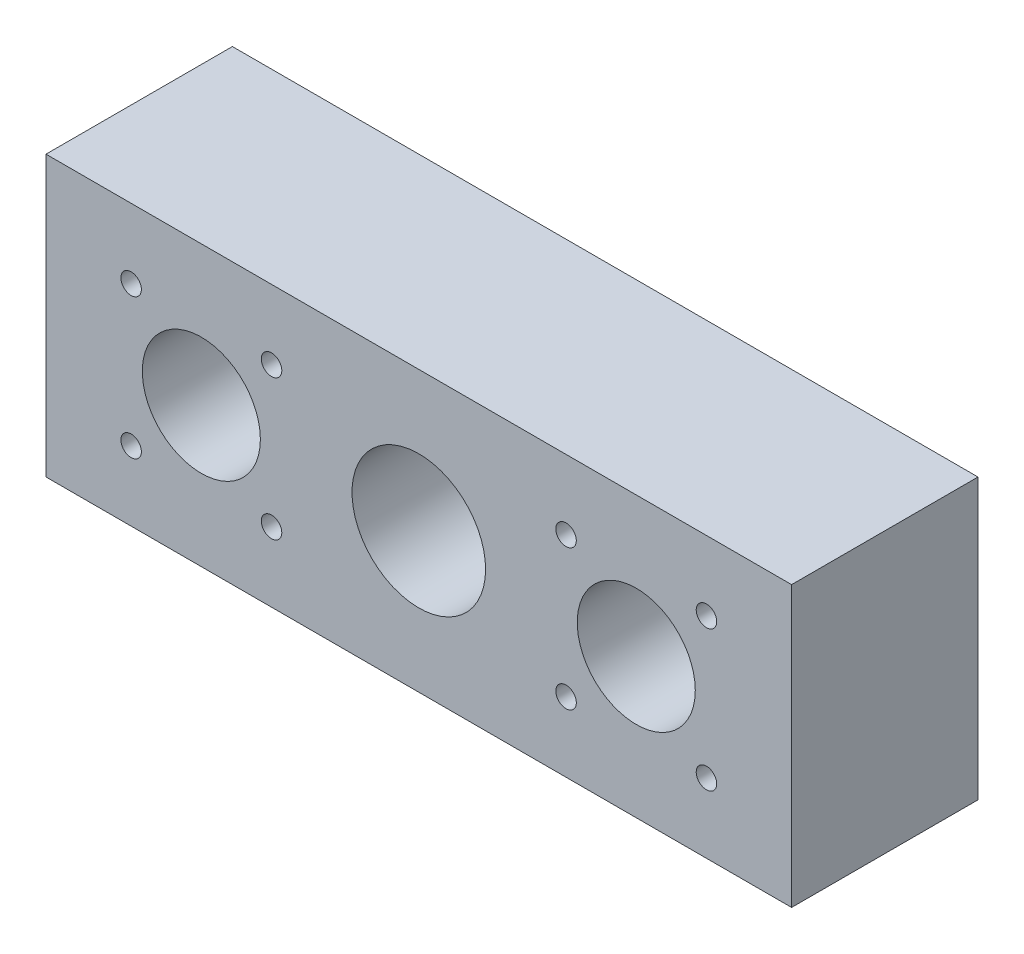
from build123d import *

# Parameters (mm, degrees)
SKETCH_1_W             = 120
SKETCH_1_H             = 45
EXTRUDE_1_DEPTH        = 30
CUT_EXTRUDE_1_REACH    = 72.755
SKETCH_2_R             = 9.5
SKETCH_2_R_2           = 10.75
HOLE_WIZARD_M4_1_D     = 3.3
HOLE_WIZARD_M4_1_DEPTH = 10.1
HOLE_WIZARD_M4_1_TIP   = 0.991420021
HOLE_WIZARD_M4_2_D     = 3.3
HOLE_WIZARD_M4_2_DEPTH = 10.1
HOLE_WIZARD_M4_2_TIP   = 0.991420021
HOLE_WIZARD_M3_1_D     = 2.5
HOLE_WIZARD_M3_1_DEPTH = 7.5
HOLE_WIZARD_M3_1_TIP   = 0.751075774


with BuildPart() as part:
    # 草图1 → 凸台-拉伸1 (new body)
    with BuildSketch(Plane.XY):
        Rectangle(SKETCH_1_W, SKETCH_1_H)
    extrude(amount=EXTRUDE_1_DEPTH)

    # 草图2 → 切除-拉伸1 (cut, up to next)
    with BuildSketch(Plane.XY.offset(30), mode=Mode.PRIVATE) as cut_extrude_1_sk1:
        with Locations((-35, 0)):
            Circle(SKETCH_2_R)
    cut_extrude_1_tool1 = extrude(cut_extrude_1_sk1.sketch, amount=-CUT_EXTRUDE_1_REACH, mode=Mode.PRIVATE) & part.part
    # 草图2 → 切除-拉伸1 (cut, up to next)
    with BuildSketch(Plane.XY.offset(30), mode=Mode.PRIVATE) as cut_extrude_1_sk2:
        with Locations((35, 0)):
            Circle(SKETCH_2_R)
    cut_extrude_1_tool2 = extrude(cut_extrude_1_sk2.sketch, amount=-CUT_EXTRUDE_1_REACH, mode=Mode.PRIVATE) & part.part
    # 草图2 → 切除-拉伸1 (cut, up to next)
    with BuildSketch(Plane.XY.offset(30), mode=Mode.PRIVATE) as cut_extrude_1_sk3:
        Circle(SKETCH_2_R_2)
    cut_extrude_1_tool3 = extrude(cut_extrude_1_sk3.sketch, amount=-CUT_EXTRUDE_1_REACH, mode=Mode.PRIVATE) & part.part
    add(cut_extrude_1_tool1.solids().sort_by_distance((-35, 0, 30))[0], mode=Mode.SUBTRACT)
    add(cut_extrude_1_tool2.solids().sort_by_distance((35, 0, 30))[0], mode=Mode.SUBTRACT)
    add(cut_extrude_1_tool3.solids().sort_by_distance((0, 0, 30))[0], mode=Mode.SUBTRACT)

    # M4 螺纹孔1
    with Locations(Plane.XY.offset(30)):
        with Locations((23.7, 11.3), (-35, 0), (-23.7, 11.3), (-46.3, -11.3), (-46.3, 11.3), (-23.7, -11.3), (46.3, 11.3), (46.3, -11.3), (23.7, -11.3)):
            Hole(HOLE_WIZARD_M4_1_D / 2, depth=HOLE_WIZARD_M4_1_DEPTH)
            with Locations((0, 0, -(HOLE_WIZARD_M4_1_DEPTH + HOLE_WIZARD_M4_1_TIP / 2))):  # 118° drill point
                Cone(0, HOLE_WIZARD_M4_1_D / 2, HOLE_WIZARD_M4_1_TIP, mode=Mode.SUBTRACT)

    # M4 螺纹孔2
    with Locations(Plane(origin=(0, 0, 0), x_dir=(-1, 0, 0), z_dir=(0, 0, -1))):
        with Locations((11.313708499, 11.313708499), (-11.313708499, -11.313708499), (-11.313708499, 11.313708499), (11.313708499, -11.313708499)):
            Hole(HOLE_WIZARD_M4_2_D / 2, depth=HOLE_WIZARD_M4_2_DEPTH)
            with Locations((0, 0, -(HOLE_WIZARD_M4_2_DEPTH + HOLE_WIZARD_M4_2_TIP / 2))):  # 118° drill point
                Cone(0, HOLE_WIZARD_M4_2_D / 2, HOLE_WIZARD_M4_2_TIP, mode=Mode.SUBTRACT)

    # M3 螺纹孔1
    with Locations(Plane(origin=(0, -22.5, 0), x_dir=(-1, 0, 0), z_dir=(0, -1, 0))):
        with Locations((-40.606601718, -4.393398282), (-19.393398282, -4.393398282), (-19.393398282, -25.606601718), (-40.606601718, -25.606601718), (19.393398282, -4.393398282), (40.606601718, -4.393398282), (19.393398282, -25.606601718), (40.606601718, -25.606601718)):
            Hole(HOLE_WIZARD_M3_1_D / 2, depth=HOLE_WIZARD_M3_1_DEPTH)
            with Locations((0, 0, -(HOLE_WIZARD_M3_1_DEPTH + HOLE_WIZARD_M3_1_TIP / 2))):  # 118° drill point
                Cone(0, HOLE_WIZARD_M3_1_D / 2, HOLE_WIZARD_M3_1_TIP, mode=Mode.SUBTRACT)


solid = part.part
